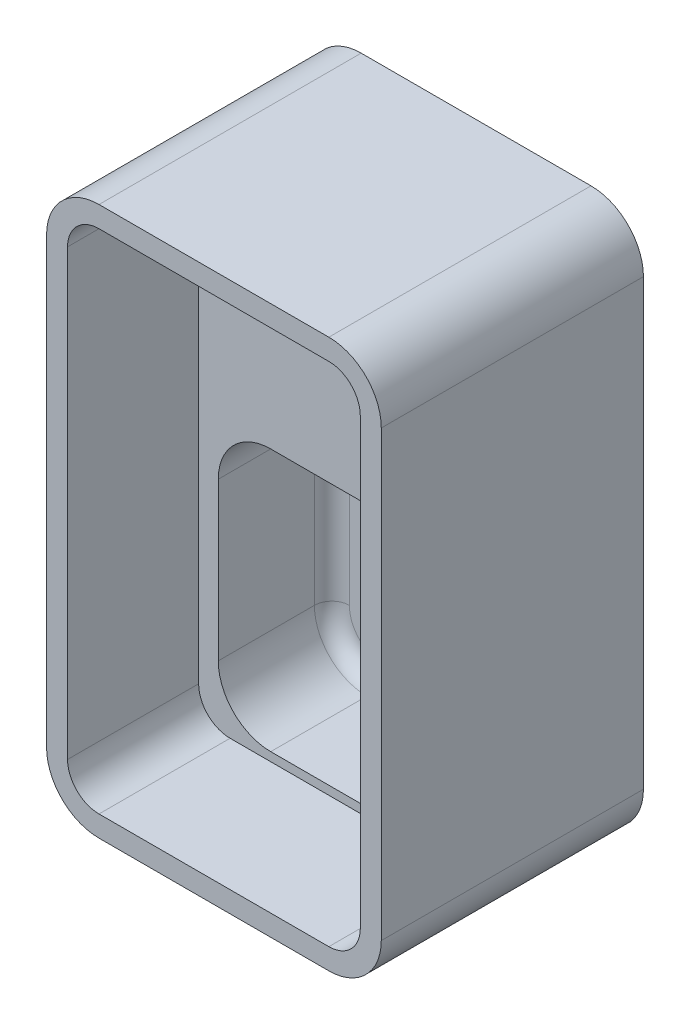
from build123d import *

# Parameters (mm, degrees)
SKETCH1_W           = 38.3
SKETCH1_H           = 62.8
SKETCH1_W_2         = 33.5
SKETCH1_H_2         = 58
SKETCH1_W_3         = 29
SKETCH1_H_3         = 30
SKETCH1_R           = 7
BOSS_EXTRUDE1_DEPTH = 2
BOSS_EXTRUDE2_START = 2
SKETCH1_3_W         = 38.3
SKETCH1_3_H         = 62.8
SKETCH1_3_W_2       = 33.5
SKETCH1_3_H_2       = 58
SKETCH1_3_W_3       = 29
SKETCH1_3_H_3       = 30
BOSS_EXTRUDE2_DEPTH = 13
BOSS_EXTRUDE3_START = 15
SKETCH1_4_W         = 38.3
SKETCH1_4_H         = 62.8
SKETCH1_4_W_2       = 33.5
SKETCH1_4_H_2       = 58
BOSS_EXTRUDE3_DEPTH = 15
FILLET1_R           = 3.6
FILLET2_R           = 6
FILLET3_R           = 2


with BuildPart() as part:
    # Sketch1 → Boss-Extrude1 (new body)
    # profile 1 of 3: a face of its own
    with BuildSketch(Plane.XY):
        with Locations((0, 13)):
            Rectangle(SKETCH1_W, SKETCH1_H)
        with Locations((0, 13)):
            Rectangle(SKETCH1_W_2, SKETCH1_H_2, mode=Mode.SUBTRACT)
    # profile 2 of 3: a face of its own
    with BuildSketch(Plane.XY):
        with Locations((0, 13)):
            Rectangle(SKETCH1_W_2, SKETCH1_H_2)
        Rectangle(SKETCH1_W_3, SKETCH1_H_3, mode=Mode.SUBTRACT)
    # profile 3 of 3: a face of its own
    with BuildSketch(Plane.XY):
        Rectangle(SKETCH1_W_3, SKETCH1_H_3)
        Circle(SKETCH1_R, mode=Mode.SUBTRACT)
    extrude(amount=BOSS_EXTRUDE1_DEPTH)

    # Sketch1<3> → Boss-Extrude2 (add)
    # profile 1 of 2: a face of its own
    with BuildSketch(Plane.XY.offset(BOSS_EXTRUDE2_START)):
        with Locations((0, 13)):
            Rectangle(SKETCH1_3_W, SKETCH1_3_H)
        with Locations((0, 13)):
            Rectangle(SKETCH1_3_W_2, SKETCH1_3_H_2, mode=Mode.SUBTRACT)
    # profile 2 of 2: a face of its own
    with BuildSketch(Plane.XY.offset(BOSS_EXTRUDE2_START)):
        with Locations((0, 13)):
            Rectangle(SKETCH1_3_W_2, SKETCH1_3_H_2)
        Rectangle(SKETCH1_3_W_3, SKETCH1_3_H_3, mode=Mode.SUBTRACT)
    extrude(amount=BOSS_EXTRUDE2_DEPTH)

    # Sketch1<4> → Boss-Extrude3 (add)
    with BuildSketch(Plane.XY.offset(BOSS_EXTRUDE3_START)):
        with Locations((0, 13)):
            Rectangle(SKETCH1_4_W, SKETCH1_4_H)
        with Locations((0, 13)):
            Rectangle(SKETCH1_4_W_2, SKETCH1_4_H_2, mode=Mode.SUBTRACT)
    extrude(amount=BOSS_EXTRUDE3_DEPTH)

    # Fillet1
    fillet1_edges = [part.edges().sort_by_distance(p)[0] for p in [
        (-16.75, 42, 22.5),
        (-16.75, -16, 22.5),
        (16.75, -16, 22.5),
        (16.75, 42, 22.5),
    ]]
    fillet(fillet1_edges, radius=FILLET1_R)

    # Fillet2
    fillet2_edges = [part.edges().sort_by_distance(p)[0] for p in [
        (19.15, -18.4, 15),
        (-19.15, -18.4, 15),
        (-19.15, 44.4, 15),
        (19.15, 44.4, 15),
        (14.5, -15, 8.5),
        (14.5, 15, 8.5),
        (-14.5, 15, 8.5),
        (-14.5, -15, 8.5),
    ]]
    fillet(fillet2_edges, radius=FILLET2_R)

    # Fillet3
    fillet3_edges = [part.edges().sort_by_distance(p)[0] for p in [
        (-14.5, 0, 2),
        (0, -15, 2),
        (14.5, 0, 2),
        (0, 15, 2),
        (12.742640687, 13.242640687, 2),
        (12.742640687, -13.242640687, 2),
        (-12.742640687, 13.242640687, 2),
        (-12.742640687, -13.242640687, 2),
    ]]
    fillet(fillet3_edges, radius=FILLET3_R)


solid = part.part
